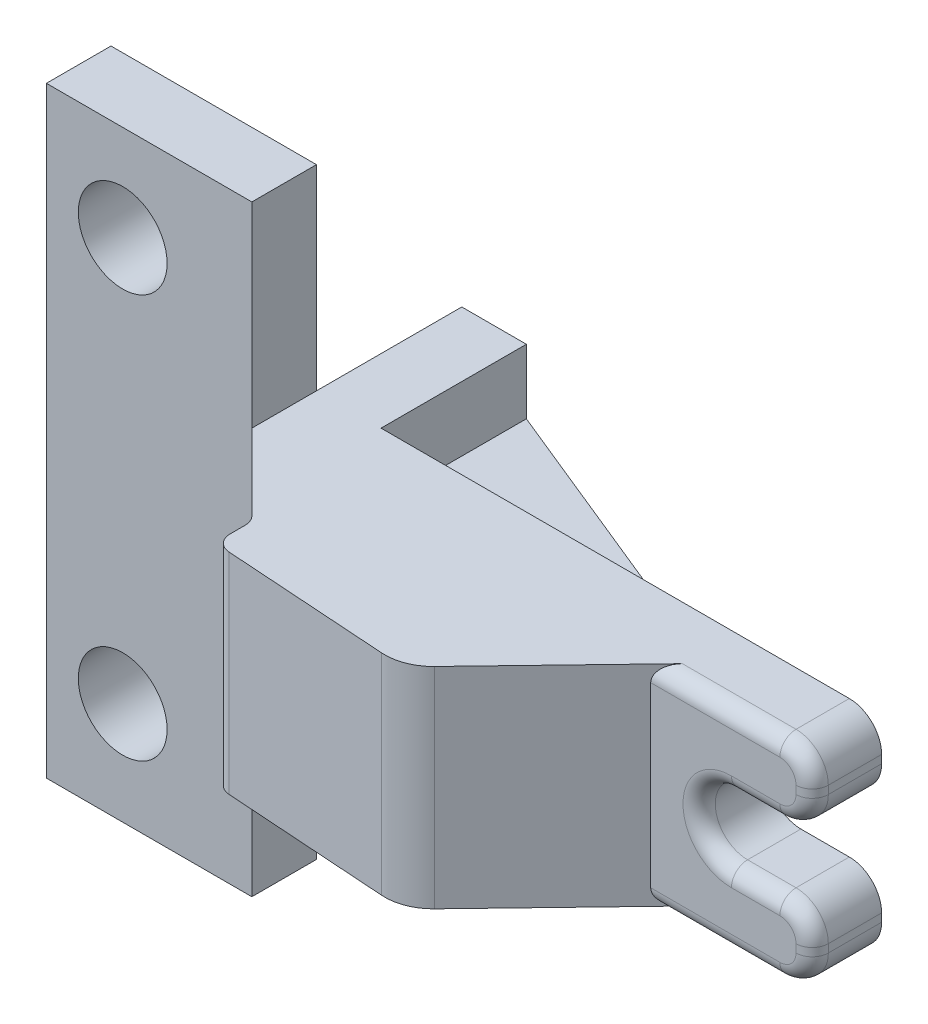
from build123d import *

# Parameters (mm, degrees)
SKETCH_2_W          = 12.724713087
SKETCH_2_H          = 37.266218859
SKETCH_2_R          = 2.75
EXTRUDE_1_DEPTH     = 4
SKETCH_3_W          = 5
SKETCH_3_H          = 13
EXTRUDE_2_DEPTH     = 4
SKETCH_4_W          = 5
SKETCH_4_H          = 13
EXTRUDE_4_DEPTH     = 9
SKETCH_5_W          = 13.3
SKETCH_5_H          = 13
EXTRUDE_5_DEPTH     = 30
CUT_EXTRUDE_2_DEPTH = 78.033997806
EXTRUDE_6_DEPTH     = 13
FILLET_4_R          = 3
SKETCH_12_W         = 31
SKETCH_12_H         = 9
CUT_EXTRUDE_3_DEPTH = 79.606298904
RIB_1_REACH         = 78.775
SKETCH_13_WALL_W    = 179.357132042
SKETCH_13_WALL_H    = 5
CHAMFER_1_SIZE      = 5
FILLET_5_R          = 1
FILLET_6_R          = 2
FILLET_7_R          = 1


with BuildPart() as part:
    # 草图2 → 凸台-拉伸1 (new body)
    with BuildSketch(Plane.XY):
        with Locations((32.137643457, -0.210903357)):
            Rectangle(SKETCH_2_W, SKETCH_2_H)
        with Locations((30.5, -12.5)):
            Circle(SKETCH_2_R, mode=Mode.SUBTRACT)
        with Locations((30.5, 12.5)):
            Circle(SKETCH_2_R, mode=Mode.SUBTRACT)
    extrude(amount=EXTRUDE_1_DEPTH)

    # 草图3 → 凸台-拉伸2 (add)
    with BuildSketch(Plane(origin=(0, 230.908781145, 0), x_dir=(-1, 0, 0), z_dir=(0, 0, 1))):
        with Locations((-41, 231.119684502)):
            Rectangle(SKETCH_3_W, SKETCH_3_H)
    extrude(amount=EXTRUDE_2_DEPTH)

    # 草图4 → 凸台-拉伸4 (add)
    with BuildSketch(Plane.XY):
        with Locations((41, -0.210903358)):
            Rectangle(SKETCH_4_W, SKETCH_4_H)
    extrude(amount=-EXTRUDE_4_DEPTH)

    # 草图5 → 凸台-拉伸5 (add)
    with BuildSketch(Plane(origin=(43.5, 0, 0), x_dir=(0, 0, -1), z_dir=(1, 0, 0))):
        with Locations((2.35, -0.210903358)):
            Rectangle(SKETCH_5_W, SKETCH_5_H)
    extrude(amount=EXTRUDE_5_DEPTH)

    # 草图9 → 切除-拉伸2 (cut, through all)
    with BuildSketch(Plane.XY.offset(4.3)):
        with BuildLine():
            Line((68.5, 1.789096642), (73.5, 1.789096642))
            Line((73.5, 1.789096642), (73.5, -2.210903358))
            Line((73.5, -2.210903358), (68.5, -2.210903358))
            ThreePointArc((68.5, -2.210903358), (66.5, -0.210903358), (68.5, 1.789096642))
        make_face()
    extrude(amount=-CUT_EXTRUDE_2_DEPTH, mode=Mode.SUBTRACT)

    # 草图10 → 凸台-拉伸6 (add)
    with BuildSketch(Plane.XZ.offset(6.710903358)):
        Polygon((43.5, 11.286784974), (55.972995456, 12.130267128), (63.5, 4.3), (43.5, 4.3), align=None)
    extrude(amount=-EXTRUDE_6_DEPTH)

    # 圆角4
    fillet_4_edges = [part.edges().sort_by_distance(p)[0] for p in [
        (55.972995456, -0.210903358, 12.130267128),
    ]]
    fillet(fillet_4_edges, radius=FILLET_4_R)

    # 草图12 → 切除-拉伸3 (cut, through all)
    with BuildSketch(Plane.XZ.offset(6.710903358)):
        with Locations((58, -4.5)):
            Rectangle(SKETCH_12_W, SKETCH_12_H)
    extrude(amount=-CUT_EXTRUDE_3_DEPTH, mode=Mode.SUBTRACT)

    # 草图13 wall → 筋1 (add, up to next)
    with BuildSketch(Plane(origin=(53.519716797, -0.210903358, -4.5), x_dir=(-0.925784246104, 0, -0.378052284302), z_dir=(0.378052284302, 0, -0.925784246104)), mode=Mode.PRIVATE) as rib_1_sk1:
        Rectangle(SKETCH_13_WALL_W, SKETCH_13_WALL_H)
    rib_1_tool1 = extrude(rib_1_sk1.sketch, amount=-RIB_1_REACH, mode=Mode.PRIVATE) - part.part
    add(rib_1_tool1.solids().sort_by_distance((53.519716797, -0.210903358, -4.5))[0])

    # 倒角1
    chamfer_1_edges = [part.edges().sort_by_distance(p)[0] for p in [
        (43.5, -0.210903358, 4),
    ]]
    chamfer(chamfer_1_edges, length=CHAMFER_1_SIZE)

    # 圆角5
    fillet_5_edges = [part.edges().sort_by_distance(p)[0] for p in [
        (43.5, -0.210903358, 9),
        (43.5, -0.210903358, 11.286784974),
    ]]
    fillet(fillet_5_edges, radius=FILLET_5_R)

    # 圆角6
    fillet_6_edges = [part.edges().sort_by_distance(p)[0] for p in [
        (73.5, 1.789096642, 2.15),
        (73.5, -2.210903358, 2.15),
        (73.5, 6.289096642, 2.15),
        (73.5, -6.710903358, 2.15),
    ]]
    fillet(fillet_6_edges, radius=FILLET_6_R)

    # 圆角7
    fillet_7_edges = [part.edges().sort_by_distance(p)[0] for p in [
        (70, 1.789096642, 4.3),
        (67.5, -6.710903358, 4.3),
        (73.5, -4.460903358, 4.3),
        (73.5, 4.039096642, 4.3),
        (67.5, 6.289096642, 4.3),
        (72.914213562, -6.12511692, 4.3),
        (72.914213562, 5.703310205, 4.3),
        (72.914213562, -2.796689795, 4.3),
        (72.914213562, 2.37488308, 4.3),
        (66.5, -0.210903358, 4.3),
        (70, -2.210903358, 4.3),
    ]]
    fillet(fillet_7_edges, radius=FILLET_7_R)


solid = part.part
